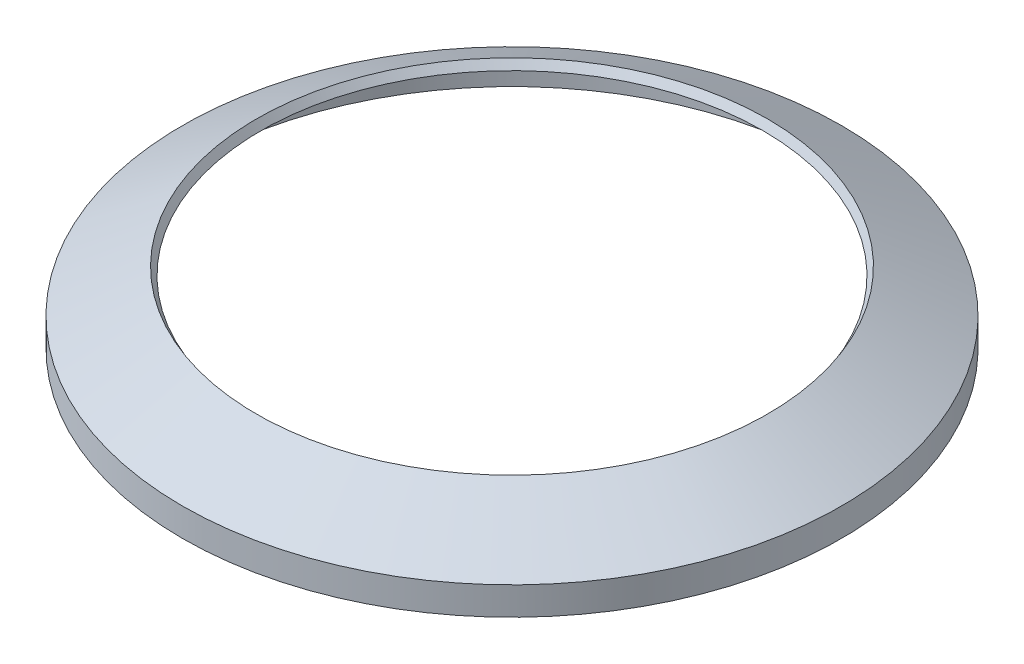
from build123d import *


with BuildPart() as part:
    # Sketch1 → Revolve-Thin1 (revolve)
    with BuildSketch(Plane.XY, mode=Mode.PRIVATE) as revolve_thin1_sk:
        Polygon((-44.577, -3.175), (-44.577, 0), (-34.925, 5.572584798), (-35.56, 6.672437061), (-45.847, 0.733234842), (-45.847, -3.175), align=None)
    revolve(revolve_thin1_sk.sketch.rotate(Axis((0, 0, 0), (0, 1, 0)), 270), axis=Axis((0, 0, 0), (0, 1, 0)))


solid = part.part
